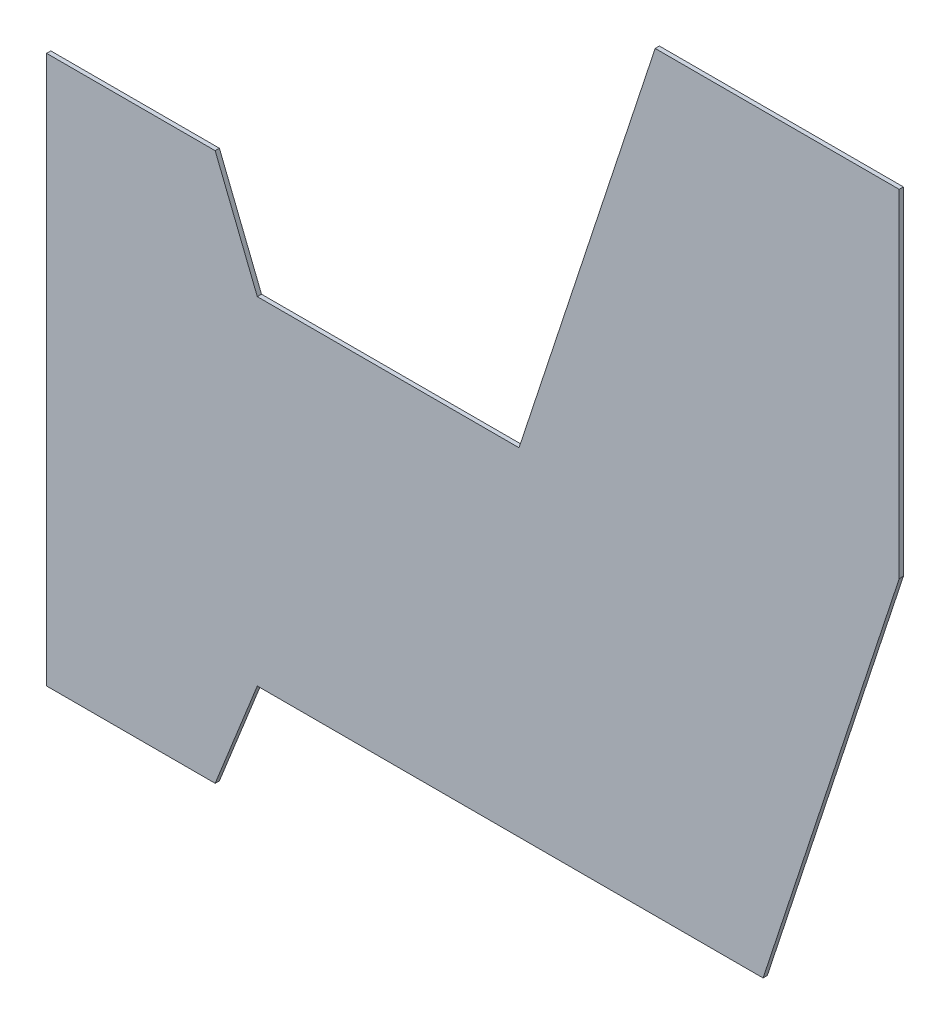
from build123d import *

# Parameters (mm, degrees)
BOSS_EXTRUDE1_DEPTH = 2.54


with BuildPart() as part:
    # Sketch1 → Boss-Extrude1 (new body)
    with BuildSketch(Plane.XY):
        Polygon((0, 0), (0, 330.2), (101.6, 330.2), (127, 266.7), (284.725894908, 266.7), (366.76607434, 516.128), (513.840179432, 516.128), (513.840179432, 312.928), (431.8, 63.5), (127, 63.5), (101.6, 0), align=None)
    extrude(amount=BOSS_EXTRUDE1_DEPTH)


solid = part.part
